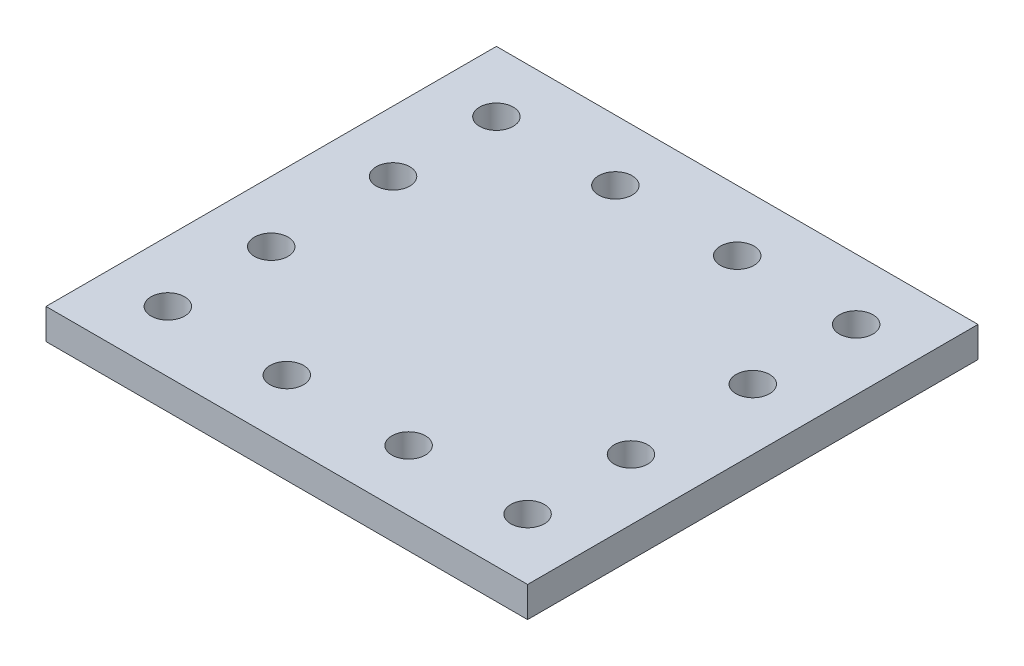
from build123d import *

# Parameters (mm, degrees)
SKETCH1_W           = 100.4
SKETCH1_H           = 93.9
BOSS_EXTRUDE1_DEPTH = 6.35
SKETCH2_R           = 3.5
CUT_EXTRUDE1_DEPTH  = 6.35
SKETCH4_R           = 3.5
CUT_EXTRUDE2_DEPTH  = 6.35


with BuildPart() as part:
    # Sketch1 → Boss-Extrude1 (new body)
    with BuildSketch(Plane(origin=(0, 0, 0), x_dir=(1, 0, 0), z_dir=(0, 1, 0))):
        with Locations((50.2, 46.95)):
            Rectangle(SKETCH1_W, SKETCH1_H)
    extrude(amount=BOSS_EXTRUDE1_DEPTH)

    # Sketch2 → Cut-Extrude1 (cut)
    with BuildSketch(Plane(origin=(0, 6.35, 0), x_dir=(1, 0, 0), z_dir=(0, 1, 0))):
        with Locations(Location((12.7, 81.2, 0), (0, 0, 270))):
            Circle(SKETCH2_R)
        with Locations(Location((12.7, 12.7, 0), (0, 0, 90))):
            Circle(SKETCH2_R)
        with Locations(Location((87.7, 12.7, 0), (0, 0, 270))):
            Circle(SKETCH2_R)
        with Locations(Location((87.7, 81.2, 0), (0, 0, 90))):
            Circle(SKETCH2_R)
    extrude(amount=-CUT_EXTRUDE1_DEPTH, mode=Mode.SUBTRACT)

    # Sketch4 → Cut-Extrude2 (cut)
    with BuildSketch(Plane(origin=(0, 6.35, 0), x_dir=(1, 0, 0), z_dir=(0, 1, 0))):
        with Locations(Location((12.7, 59.65, 0), (0, 0, 270))):
            Circle(SKETCH4_R)
        with Locations(Location((12.7, 34.25, 0), (0, 0, 90))):
            Circle(SKETCH4_R)
        with Locations(Location((87.7, 34.25, 0), (0, 0, 270))):
            Circle(SKETCH4_R)
        with Locations(Location((87.7, 59.65, 0), (0, 0, 90))):
            Circle(SKETCH4_R)
        with Locations(Location((37.5, 81.2, 0), (0, 0, 270))):
            Circle(SKETCH4_R)
        with Locations(Location((62.9, 81.2, 0), (0, 0, 90))):
            Circle(SKETCH4_R)
        with Locations(Location((62.9, 12.7, 0), (0, 0, 270))):
            Circle(SKETCH4_R)
        with Locations(Location((37.5, 12.7, 0), (0, 0, 90))):
            Circle(SKETCH4_R)
    extrude(amount=-CUT_EXTRUDE2_DEPTH, mode=Mode.SUBTRACT)


solid = part.part
